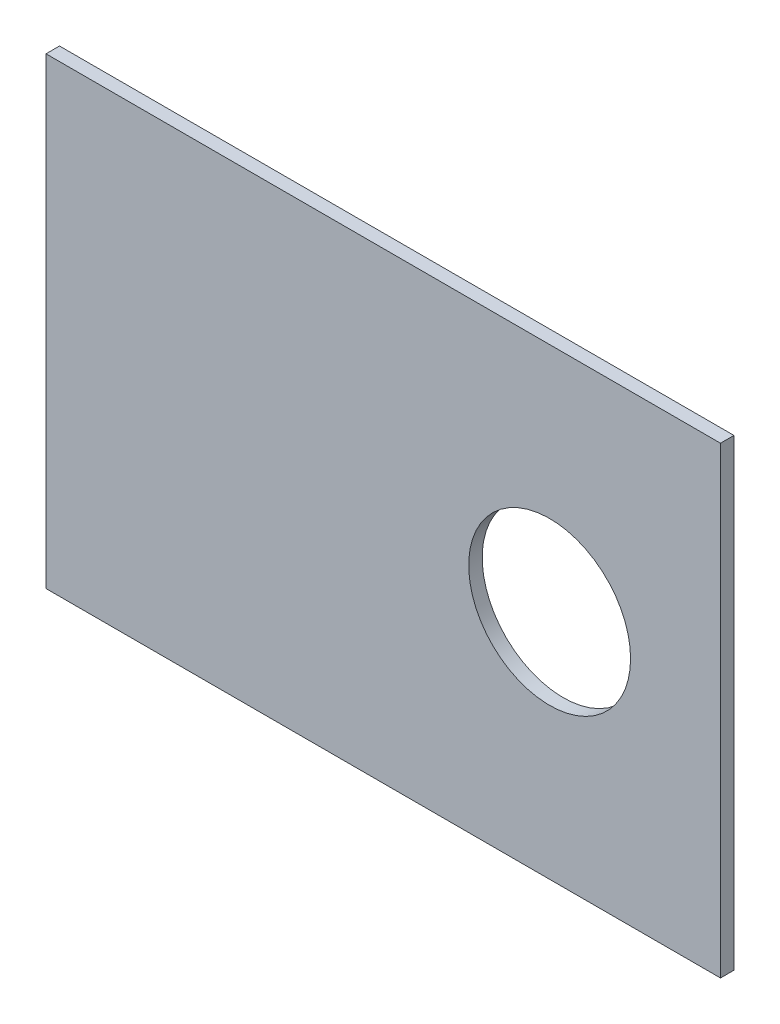
from build123d import *

# Parameters (mm, degrees)
CROQUIS1_W              = 150
CROQUIS1_H              = 103
CROQUIS1_R              = 18
SALIENTE_EXTRUIR1_DEPTH = 3


with BuildPart() as part:
    # Croquis1 → Saliente-Extruir1 (new body)
    with BuildSketch(Plane.XY):
        Rectangle(CROQUIS1_W, CROQUIS1_H)
        with Locations((37, 0)):
            Circle(CROQUIS1_R, mode=Mode.SUBTRACT)
    extrude(amount=SALIENTE_EXTRUIR1_DEPTH)


solid = part.part
